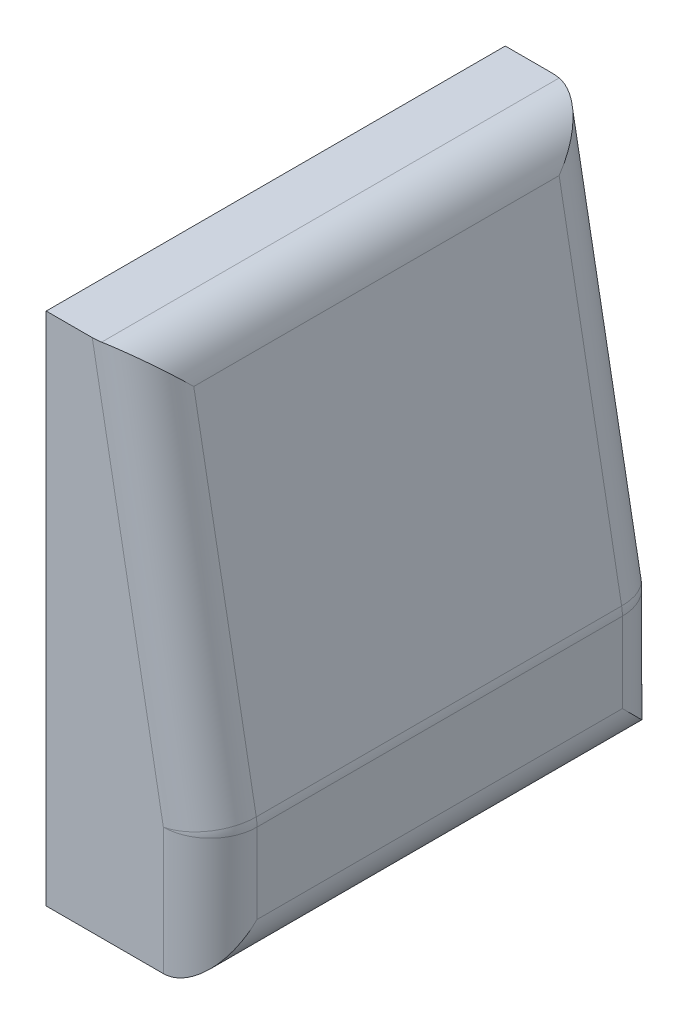
from build123d import *

# Parameters (mm, degrees)
BOSS_EXTRUDE1_DEPTH = 490
FILLET1_R           = 100


with BuildPart() as part:
    # Sketch1 → Boss-Extrude1 (new, symmetric)
    with BuildSketch(Plane.XY):
        Polygon((0, 550), (0, -550), (350, -550), (350, -270), (200, 550), align=None)
    extrude(amount=BOSS_EXTRUDE1_DEPTH, both=True)

    # Fillet1
    fillet1_edges = [part.edges().sort_by_distance(p)[0] for p in [
        (350, -410, 490),
        (275, 140, 490),
        (275, 140, -490),
        (350, -410, -490),
        (200, 550, 0),
        (350, -270, 0),
        (350, -550, 0),
    ]]
    fillet(fillet1_edges, radius=FILLET1_R)


solid = part.part
